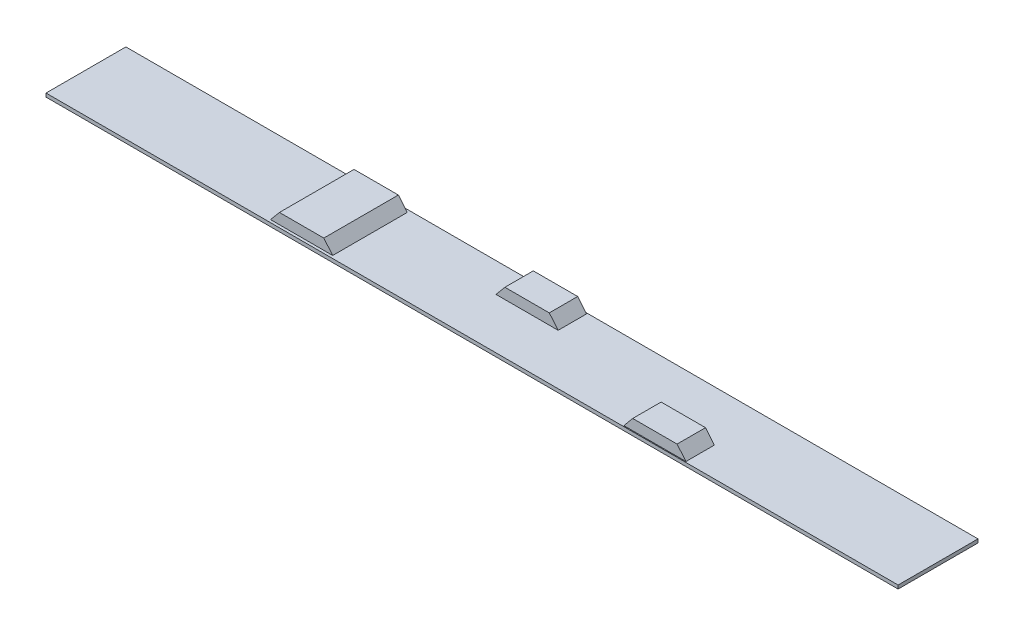
from build123d import *

# Parameters (mm, degrees)
SKETCH2_W                = 2400
SKETCH2_H                = 225
BOSS_EXTRUDE1_DEPTH      = 10
BOSS_EXTRUDE2_START      = 30
BOSS_EXTRUDE2_DEPTH      = 80
BOSS_EXTRUDE3_START      = -110
BOSS_EXTRUDE3_DEPTH      = 80
BOSS_EXTRUDE4_DEPTH      = 105
BOSS_EXTRUDE4_DEPTH_BACK = 105


with BuildPart() as part:
    # Sketch2 → Boss-Extrude1 (new body)
    with BuildSketch(Plane(origin=(0, 0, 0), x_dir=(1, 0, 0), z_dir=(0, 1, 0))):
        Rectangle(SKETCH2_W, SKETCH2_H)
    extrude(amount=BOSS_EXTRUDE1_DEPTH)

    # Sketch3 → Boss-Extrude2 (add)
    with BuildSketch(Plane.XY.offset(BOSS_EXTRUDE2_START)):
        Polygon((425, 10), (450, 40), (575, 40), (600, 10), align=None)
    extrude(amount=BOSS_EXTRUDE2_DEPTH)

    # Sketch4 → Boss-Extrude3 (add)
    with BuildSketch(Plane.XY.offset(BOSS_EXTRUDE3_START)):
        Polygon((-50, 40), (-75, 10), (100, 10), (75, 40), align=None)
    extrude(amount=BOSS_EXTRUDE3_DEPTH)

    # Sketch5 → Boss-Extrude4 (add, two sides: drawn at the far end of the back side and taken through both)
    with BuildSketch(Plane.XY.offset(-BOSS_EXTRUDE4_DEPTH_BACK)):
        Polygon((-550, 40), (-575, 10), (-400, 10), (-425, 40), align=None)
    extrude(amount=BOSS_EXTRUDE4_DEPTH + BOSS_EXTRUDE4_DEPTH_BACK)


solid = part.part
